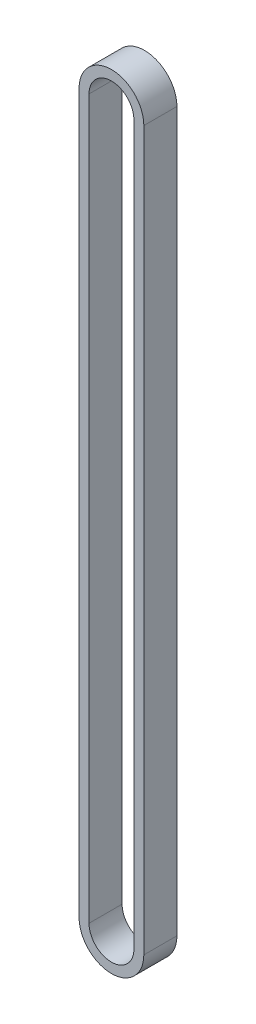
from build123d import *

# Parameters (mm, degrees)
EXTRUDE_1_DEPTH = 10


with BuildPart() as part:
    # 草图1 → 凸台-拉伸1 (new body)
    with BuildSketch(Plane.XY):
        with BuildLine():
            Line((-9.78, -108.5), (-9.78, 108.5))
            ThreePointArc((-9.78, 108.5), (0, 118.28), (9.78, 108.5))
            Line((9.78, 108.5), (9.78, -108.5))
            ThreePointArc((9.78, -108.5), (0, -118.28), (-9.78, -108.5))
        make_face()
        with BuildLine():
            Line((-6.78, -108.5), (-6.78, 108.5))
            ThreePointArc((-6.78, 108.5), (0, 115.28), (6.78, 108.5))
            Line((6.78, 108.5), (6.78, -108.5))
            ThreePointArc((6.78, -108.5), (0, -115.28), (-6.78, -108.5))
        make_face(mode=Mode.SUBTRACT)
    extrude(amount=EXTRUDE_1_DEPTH)


solid = part.part
